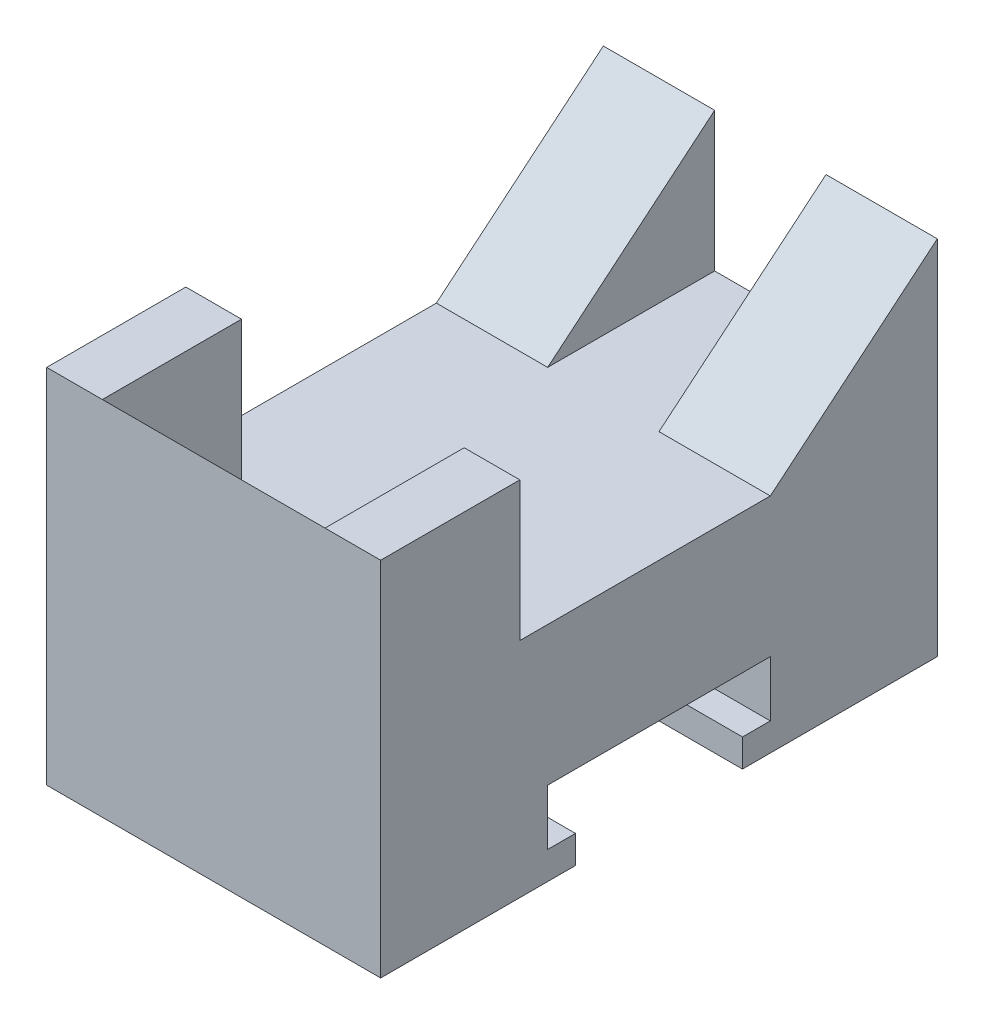
from build123d import *

# Parameters (mm, degrees)
BOSS_EXTRUDE1_DEPTH      = 150
BOSS_EXTRUDE1_DEPTH_BACK = 150
SKETCH3_W                = 50
SKETCH3_H                = 125
BOSS_EXTRUDE2_DEPTH      = 125
SKETCH4_W                = 100
SKETCH4_H                = 125
CUT_EXTRUDE1_DEPTH       = 230


with BuildPart() as part:
    # Sketch1 → Boss-Extrude1 (new, two sides: drawn at the far end of the back side and taken through both)
    with BuildSketch(Plane(origin=(0, 0, 0), x_dir=(0, 0, -1), z_dir=(1, 0, 0)).offset(-BOSS_EXTRUDE1_DEPTH_BACK)):
        Polygon((0, 0), (-175, 0), (-175, 25), (-150, 25), (-150, 75), (-350, 75), (-350, 25), (-325, 25), (-325, 0), (-500, 0), (-500, 325), (-375, 200), (-150, 200), (0, 325), align=None)
    extrude(amount=BOSS_EXTRUDE1_DEPTH + BOSS_EXTRUDE1_DEPTH_BACK)

    # Sketch3 → Boss-Extrude2 (add)
    with BuildSketch(Plane(origin=(0, 200, 0), x_dir=(1, 0, 0), z_dir=(0, 1, 0))):
        with Locations((125, -437.5)):
            Rectangle(SKETCH3_W, SKETCH3_H)
        with Locations((-125, -437.5)):
            Rectangle(SKETCH3_W, SKETCH3_H)
    extrude(amount=BOSS_EXTRUDE2_DEPTH)

    # Sketch4 → Cut-Extrude1 (cut)
    with BuildSketch(Plane(origin=(0, 0, 0), x_dir=(-1, 0, 0), z_dir=(0, 0, -1))):
        with Locations((0, 262.5)):
            Rectangle(SKETCH4_W, SKETCH4_H)
    extrude(amount=-CUT_EXTRUDE1_DEPTH, mode=Mode.SUBTRACT)


solid = part.part
